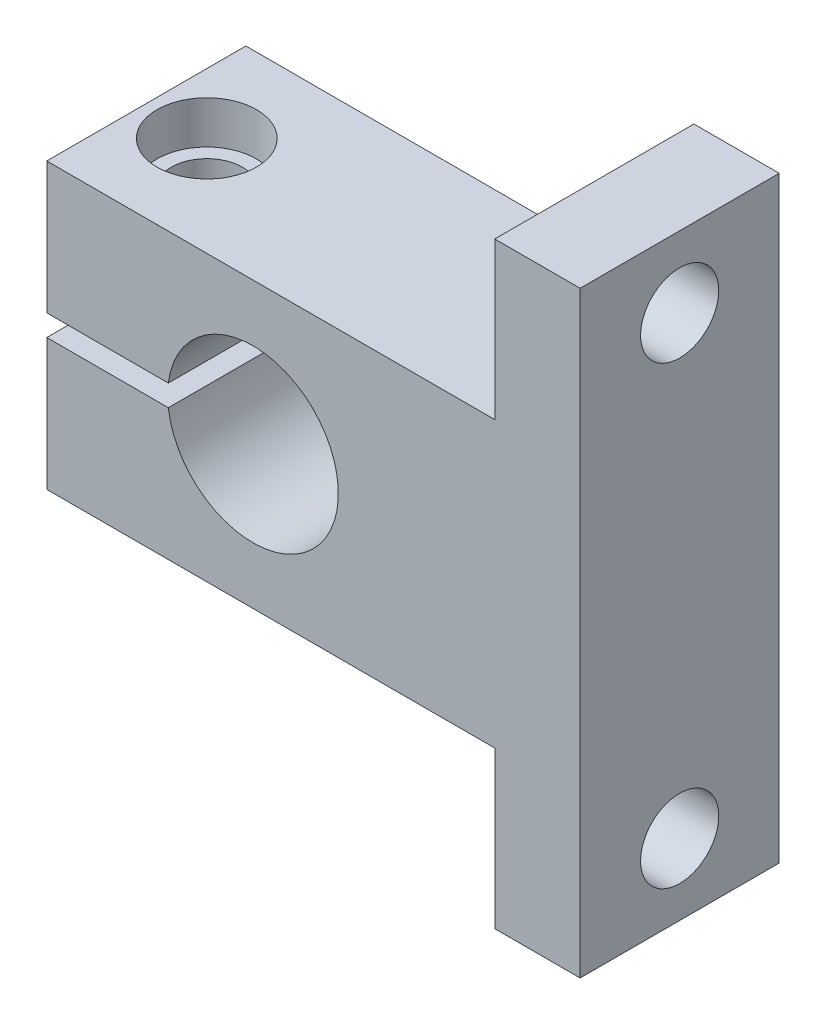
from build123d import *

# Parameters (mm, degrees)
EXTRUS_O1_DEPTH               = 14
EXTRUS_O2_REACH               = 52.629
ESBO_O2_R                     = 2.5
FURO_ROSCADO_DE_M4X0_71_D     = 3.3
FURO_ROSCADO_DE_M4X0_71_DEPTH = 11.5
FURO_ROSCADO_DE_M4X0_71_TIP   = 0.991420021
ESBO_O5_R                     = 2.75
EXTRUS_O3_DEPTH               = 55.334611437
ESBO_O6_R                     = 3.5
EXTRUS_O4_DEPTH               = 3


with BuildPart() as part:
    # Esboço1 → Extrusão1 (new body)
    with BuildSketch(Plane.XY):
        with BuildLine():
            Line((0, 0), (0, 42))
            Line((0, 42), (-6, 42))
            Line((-6, 42), (-6, 31))
            Line((-6, 31), (-37.5, 31))
            Line((-37.5, 31), (-37.5, 21.75))
            Line((-37.5, 21.75), (-28.95294045, 21.75))
            ThreePointArc((-28.95294045, 21.75), (-17, 21), (-28.95294045, 20.25))
            Line((-28.95294045, 20.25), (-37.5, 20.25))
            Line((-37.5, 20.25), (-37.5, 11))
            Line((-37.5, 11), (-6, 11))
            Line((-6, 11), (-6, 0))
            Line((-6, 0), (0, 0))
        make_face()
    extrude(amount=EXTRUS_O1_DEPTH)

    # Esboço2 → Extrusão2 (cut, up to next)
    with BuildSketch(Plane(origin=(0, 31, 0), x_dir=(1, 0, 0), z_dir=(0, 1, 0)), mode=Mode.PRIVATE) as extrus_o2_sk1:
        with Locations(Location((-33.25, -7, 0), (0, 0, 270))):
            Circle(ESBO_O2_R)
    extrus_o2_tool1 = extrude(extrus_o2_sk1.sketch, amount=-EXTRUS_O2_REACH, mode=Mode.PRIVATE) & part.part
    add(extrus_o2_tool1.solids().sort_by_distance((-33.25, 31, 7))[0], mode=Mode.SUBTRACT)

    # Furo roscado de M4x0.71
    with Locations(Plane(origin=(-33.25, 20.25, 7), x_dir=(0, 0, 1), z_dir=(0, 1, 0))):
        with Locations((0, 0)):
            Hole(FURO_ROSCADO_DE_M4X0_71_D / 2, depth=FURO_ROSCADO_DE_M4X0_71_DEPTH)
            with Locations((0, 0, -(FURO_ROSCADO_DE_M4X0_71_DEPTH + FURO_ROSCADO_DE_M4X0_71_TIP / 2))):  # 118° drill point
                Cone(0, FURO_ROSCADO_DE_M4X0_71_D / 2, FURO_ROSCADO_DE_M4X0_71_TIP, mode=Mode.SUBTRACT)

    # Esboço5 → Extrusão3 (cut, through all)
    with BuildSketch(Plane.ZY.offset(6)):
        with Locations(Location((7, 37, 0), (0, 0, 270))):
            Circle(ESBO_O5_R)
        with Locations(Location((7, 5, 0), (0, 0, 270))):
            Circle(ESBO_O5_R)
    extrude(amount=-EXTRUS_O3_DEPTH, mode=Mode.SUBTRACT)

    # Esboço6 → Extrusão4 (cut)
    with BuildSketch(Plane(origin=(0, 31, 0), x_dir=(1, 0, 0), z_dir=(0, 1, 0))):
        with Locations(Location((-33.25, -7, 0), (0, 0, 270))):
            Circle(ESBO_O6_R)
    extrude(amount=-EXTRUS_O4_DEPTH, mode=Mode.SUBTRACT)


solid = part.part
